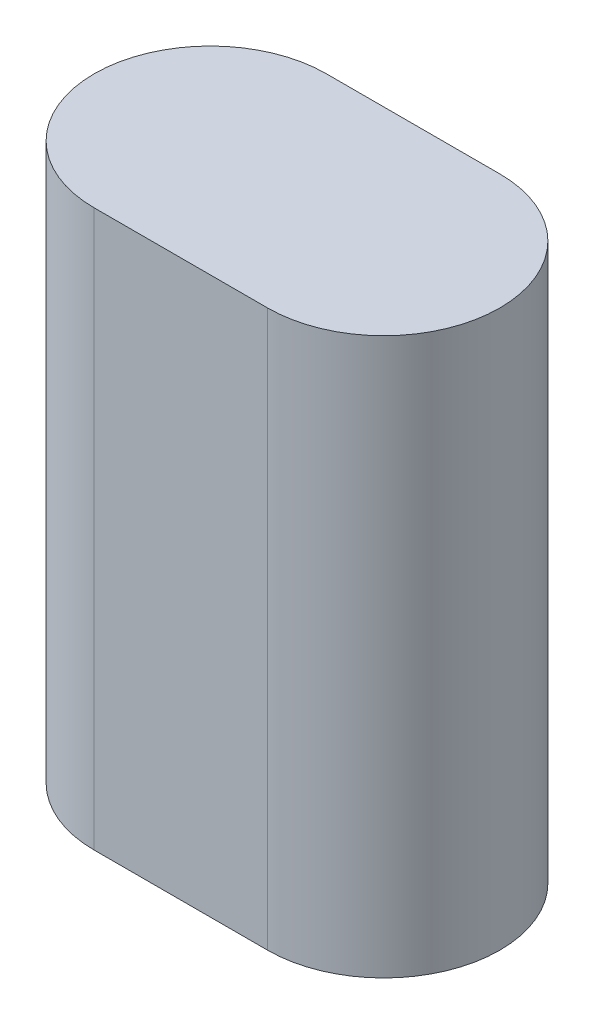
from build123d import *

# Parameters (mm, degrees)
BOSS_EXTRUDE1_DEPTH = 30.59


with BuildPart() as part:
    # Sketch1 → Boss-Extrude1 (new body)
    with BuildSketch(Plane(origin=(0, 0, 0), x_dir=(1, 0, 0), z_dir=(0, 1, 0))):
        with BuildLine():
            Line((-4.77, 6.385), (4.77, 6.385))
            ThreePointArc((4.77, 6.385), (11.155, 0), (4.77, -6.385))
            Line((4.77, -6.385), (-4.77, -6.385))
            ThreePointArc((-4.77, -6.385), (-11.155, 0), (-4.77, 6.385))
        make_face()
    extrude(amount=BOSS_EXTRUDE1_DEPTH)


solid = part.part
